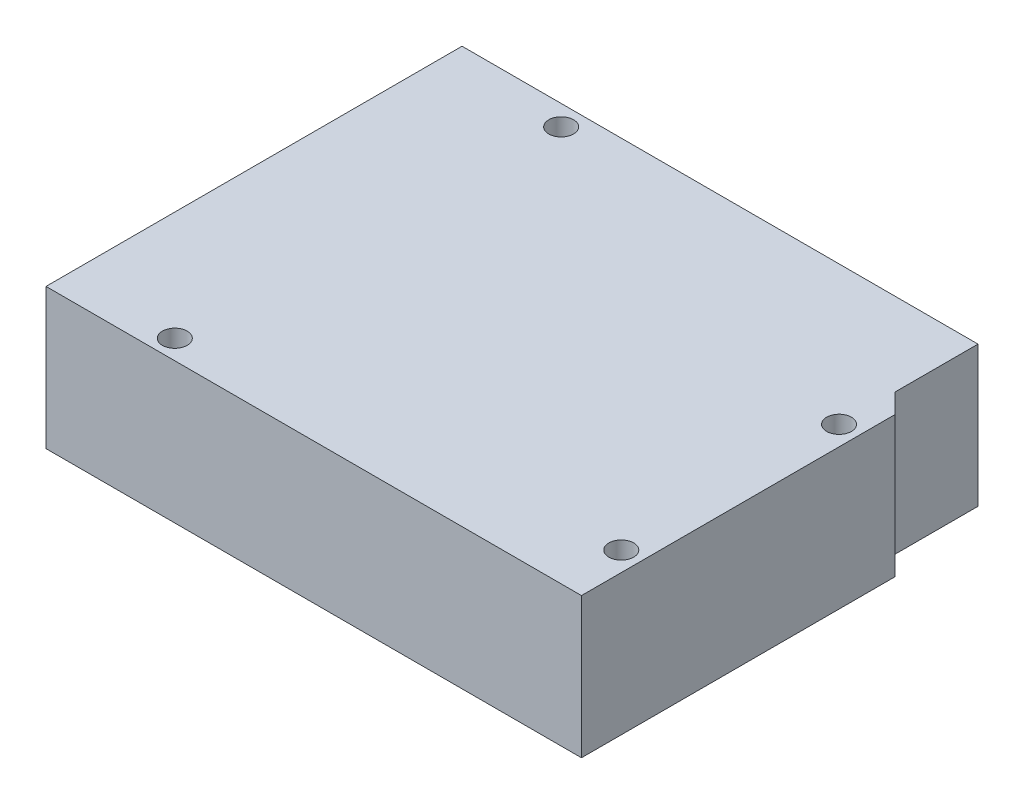
from build123d import *

# Parameters (mm, degrees)
SKETCH_1_R      = 1.5875
EXTRUDE_1_DEPTH = 18


with BuildPart() as part:
    # 草图1 → 凸台-拉伸1 (new body)
    with BuildSketch(Plane(origin=(0, 0, 0), x_dir=(1, 0, 0), z_dir=(0, 1, 0))):
        Polygon((31.8, 26.65), (-34.3, 26.65), (-34.3, -26.65), (34.3, -26.65), (34.3, 13.519706399), (31.8, 16.019706399), align=None)
        with Locations(Location((-20.3, -24.15, 0), (0, 0, 270))):
            Circle(SKETCH_1_R, mode=Mode.SUBTRACT)
        with Locations(Location((31.8, -19.05, 0), (0, 0, 270))):
            Circle(SKETCH_1_R, mode=Mode.SUBTRACT)
        with Locations(Location((-19, 24.05, 0), (0, 0, 270))):
            Circle(SKETCH_1_R, mode=Mode.SUBTRACT)
        with Locations(Location((31.8, 8.85, 0), (0, 0, 270))):
            Circle(SKETCH_1_R, mode=Mode.SUBTRACT)
    extrude(amount=EXTRUDE_1_DEPTH)


solid = part.part
